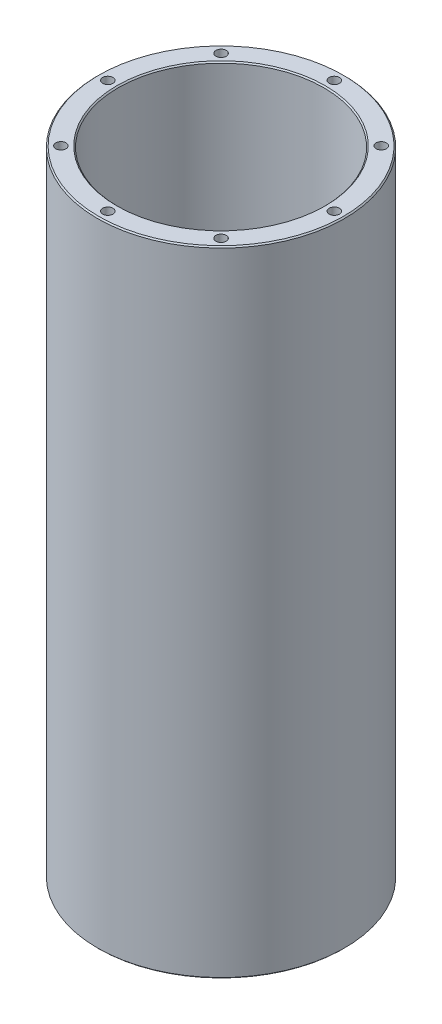
from build123d import *

# Parameters (mm, degrees)
BOSS_EXTRUDE1_DEPTH              = 154
BOSS_EXTRUDE1_DEPTH_BACK         = 154
SKETCH1_R                        = 60
SKETCH1_R_2                      = 50
TAP_DRILL_FOR_M6_TAP1_AT_2_COUNT = 2
TAP_DRILL_FOR_M6_TAP1_AT_2_PITCH = 42.09517756
TAP_DRILL_FOR_M6_TAP1_AT_3_COUNT = 2
TAP_DRILL_FOR_M6_TAP1_AT_3_PITCH = 77.781745931
TAP_DRILL_FOR_M6_TAP1_AT_4_COUNT = 2
TAP_DRILL_FOR_M6_TAP1_AT_4_PITCH = 101.626748576
TAP_DRILL_FOR_M6_TAP1_AT_5_COUNT = 2
TAP_DRILL_FOR_M6_TAP1_AT_5_PITCH = 110
TAP_DRILL_FOR_M6_TAP1_AT_6_COUNT = 2
TAP_DRILL_FOR_M6_TAP1_AT_6_PITCH = 101.626748576
TAP_DRILL_FOR_M6_TAP1_AT_7_COUNT = 2
TAP_DRILL_FOR_M6_TAP1_AT_7_PITCH = 77.781745931
TAP_DRILL_FOR_M6_TAP1_AT_8_COUNT = 2
TAP_DRILL_FOR_M6_TAP1_AT_8_PITCH = 42.09517756
CHAMFER1_SIZE                    = 0.6


with BuildPart() as part:
    # Sketch1 → Boss-Extrude1 (new, two sides: drawn at the far end of the back side and taken through both)
    with BuildSketch(Plane(origin=(0, 0, 0), x_dir=(1, 0, 0), z_dir=(0, 1, 0)).offset(-BOSS_EXTRUDE1_DEPTH_BACK)):
        with Locations(Location((0, 0, 0), (0, 0, 270))):
            Circle(SKETCH1_R)
        with Locations(Location((0, 0, 0), (0, 0, 270))):
            Circle(SKETCH1_R_2, mode=Mode.SUBTRACT)
    extrude(amount=BOSS_EXTRUDE1_DEPTH + BOSS_EXTRUDE1_DEPTH_BACK)

    # Sketch3 → Tap Drill for M6 Tap1 (revolve, cut)
    with BuildSketch(Plane(origin=(-38.890872965, 154, -38.890872965), x_dir=(0, 0, 1), z_dir=(1, 0, 0))):
        Polygon((0, 0), (0, 16.502151548), (2.5, 15), (2.5, 0), align=None)
    tap_drill_for_m6_tap1 = revolve(axis=Axis((-38.890872965, 160.35, -38.890872965), (0, -1, 0)), mode=Mode.SUBTRACT)

    # Tap Drill for M6 Tap1 at 2: Tap Drill for M6 Tap1 ×2
    with Locations(*[Vector(0.92387953251135, 0, -0.3826834323649371) * (i * TAP_DRILL_FOR_M6_TAP1_AT_2_PITCH) for i in range(1, TAP_DRILL_FOR_M6_TAP1_AT_2_COUNT)]):
        add(tap_drill_for_m6_tap1, mode=Mode.SUBTRACT)

    # Tap Drill for M6 Tap1 at 3: Tap Drill for M6 Tap1 ×2
    with Locations(*[(i * TAP_DRILL_FOR_M6_TAP1_AT_3_PITCH, 0, 0) for i in range(1, TAP_DRILL_FOR_M6_TAP1_AT_3_COUNT)]):
        add(tap_drill_for_m6_tap1, mode=Mode.SUBTRACT)

    # Tap Drill for M6 Tap1 at 4: Tap Drill for M6 Tap1 ×2
    with Locations(*[Vector(0.9238795325112054, 0, 0.3826834323652862) * (i * TAP_DRILL_FOR_M6_TAP1_AT_4_PITCH) for i in range(1, TAP_DRILL_FOR_M6_TAP1_AT_4_COUNT)]):
        add(tap_drill_for_m6_tap1, mode=Mode.SUBTRACT)

    # Tap Drill for M6 Tap1 at 5: Tap Drill for M6 Tap1 ×2
    with Locations(*[Vector(0.7071067811863805, 0, 0.7071067811867146) * (i * TAP_DRILL_FOR_M6_TAP1_AT_5_PITCH) for i in range(1, TAP_DRILL_FOR_M6_TAP1_AT_5_COUNT)]):
        add(tap_drill_for_m6_tap1, mode=Mode.SUBTRACT)

    # Tap Drill for M6 Tap1 at 6: Tap Drill for M6 Tap1 ×2
    with Locations(*[Vector(0.38268343236484964, 0, 0.9238795325113862) * (i * TAP_DRILL_FOR_M6_TAP1_AT_6_PITCH) for i in range(1, TAP_DRILL_FOR_M6_TAP1_AT_6_COUNT)]):
        add(tap_drill_for_m6_tap1, mode=Mode.SUBTRACT)

    # Tap Drill for M6 Tap1 at 7: Tap Drill for M6 Tap1 ×2
    with Locations(*[(0, 0, i * TAP_DRILL_FOR_M6_TAP1_AT_7_PITCH) for i in range(1, TAP_DRILL_FOR_M6_TAP1_AT_7_COUNT)]):
        add(tap_drill_for_m6_tap1, mode=Mode.SUBTRACT)

    # Tap Drill for M6 Tap1 at 8: Tap Drill for M6 Tap1 ×2
    with Locations(*[Vector(-0.38268343236537383, 0, 0.9238795325111692) * (i * TAP_DRILL_FOR_M6_TAP1_AT_8_PITCH) for i in range(1, TAP_DRILL_FOR_M6_TAP1_AT_8_COUNT)]):
        add(tap_drill_for_m6_tap1, mode=Mode.SUBTRACT)

    # Mirror1: Tap Drill for M6 Tap1 across plane
    add(tap_drill_for_m6_tap1.mirror(Plane.ZX), mode=Mode.SUBTRACT)

    # Mirror1 copy 1 sketch → Mirror1 copy 1 (revolve, cut)
    with BuildSketch(Plane(origin=(0, -154, -55), x_dir=(0, 0, 1), z_dir=(1, 0, 0))):
        Polygon((0, 0), (0, -16.502151548), (2.5, -15), (2.5, 0), align=None)
    revolve(axis=Axis((0, -160.35, -55), (0, -1, 0)), mode=Mode.SUBTRACT)

    # Mirror1 copy 2 sketch → Mirror1 copy 2 (revolve, cut)
    with BuildSketch(Plane(origin=(38.890872965, -154, -38.890872965), x_dir=(0, 0, 1), z_dir=(1, 0, 0))):
        Polygon((0, 0), (0, -16.502151548), (2.5, -15), (2.5, 0), align=None)
    revolve(axis=Axis((38.890872965, -160.35, -38.890872965), (0, -1, 0)), mode=Mode.SUBTRACT)

    # Mirror1 copy 3 sketch → Mirror1 copy 3 (revolve, cut)
    with BuildSketch(Plane(origin=(55, -154, 0), x_dir=(0, 0, 1), z_dir=(1, 0, 0))):
        Polygon((0, 0), (0, -16.502151548), (2.5, -15), (2.5, 0), align=None)
    revolve(axis=Axis((55, -160.35, 0), (0, -1, 0)), mode=Mode.SUBTRACT)

    # Mirror1 copy 4 sketch → Mirror1 copy 4 (revolve, cut)
    with BuildSketch(Plane(origin=(38.890872965, -154, 38.890872965), x_dir=(0, 0, 1), z_dir=(1, 0, 0))):
        Polygon((0, 0), (0, -16.502151548), (2.5, -15), (2.5, 0), align=None)
    revolve(axis=Axis((38.890872965, -160.35, 38.890872965), (0, -1, 0)), mode=Mode.SUBTRACT)

    # Mirror1 copy 5 sketch → Mirror1 copy 5 (revolve, cut)
    with BuildSketch(Plane(origin=(0, -154, 55), x_dir=(0, 0, 1), z_dir=(1, 0, 0))):
        Polygon((0, 0), (0, -16.502151548), (2.5, -15), (2.5, 0), align=None)
    revolve(axis=Axis((0, -160.35, 55), (0, -1, 0)), mode=Mode.SUBTRACT)

    # Mirror1 copy 6 sketch → Mirror1 copy 6 (revolve, cut)
    with BuildSketch(Plane(origin=(-38.890872965, -154, 38.890872965), x_dir=(0, 0, 1), z_dir=(1, 0, 0))):
        Polygon((0, 0), (0, -16.502151548), (2.5, -15), (2.5, 0), align=None)
    revolve(axis=Axis((-38.890872965, -160.35, 38.890872965), (0, -1, 0)), mode=Mode.SUBTRACT)

    # Mirror1 copy 7 sketch → Mirror1 copy 7 (revolve, cut)
    with BuildSketch(Plane(origin=(-55, -154, 0), x_dir=(0, 0, 1), z_dir=(1, 0, 0))):
        Polygon((0, 0), (0, -16.502151548), (2.5, -15), (2.5, 0), align=None)
    revolve(axis=Axis((-55, -160.35, 0), (0, -1, 0)), mode=Mode.SUBTRACT)

    # Chamfer1
    chamfer1_edges = [part.edges().sort_by_distance(p)[0] for p in [
        (0, 154, -60),
        (0, 154, -50),
        (0, -154, -60),
        (0, -154, -50),
    ]]
    chamfer(chamfer1_edges, length=CHAMFER1_SIZE)


solid = part.part
